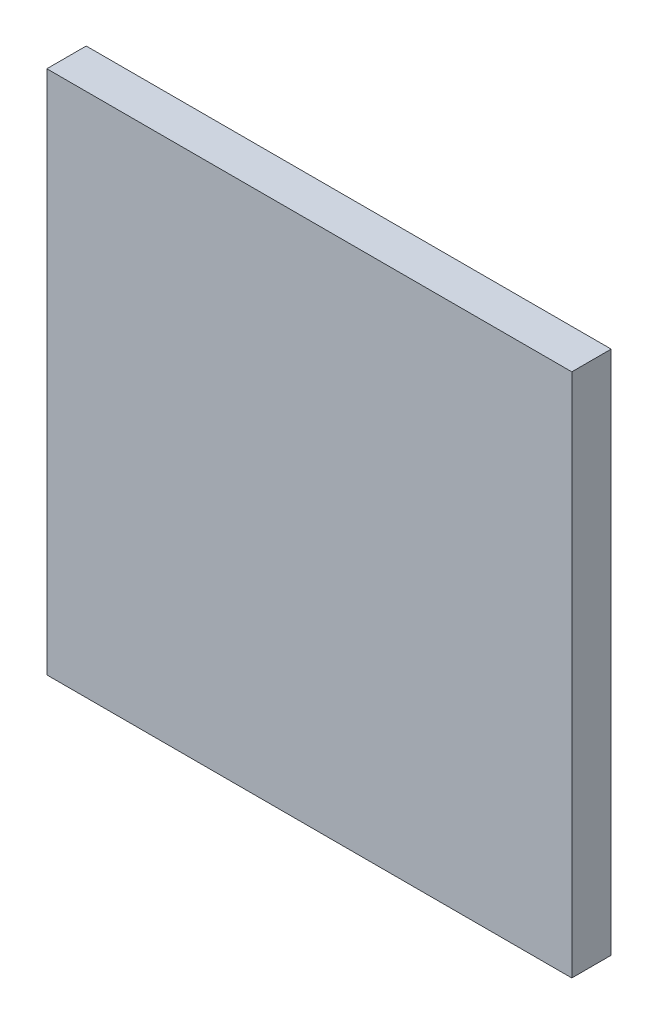
from build123d import *

# Parameters (mm, degrees)
SKETCH_1_W              = 0.4
SKETCH_1_H              = 0.4
COMPONENT_OUTLINE_DEPTH = 0.03


with BuildPart() as part:
    # 草图1 → Component_Outline (new body)
    with BuildSketch(Plane.XY):
        Rectangle(SKETCH_1_W, SKETCH_1_H)
    extrude(amount=COMPONENT_OUTLINE_DEPTH)


solid = part.part
